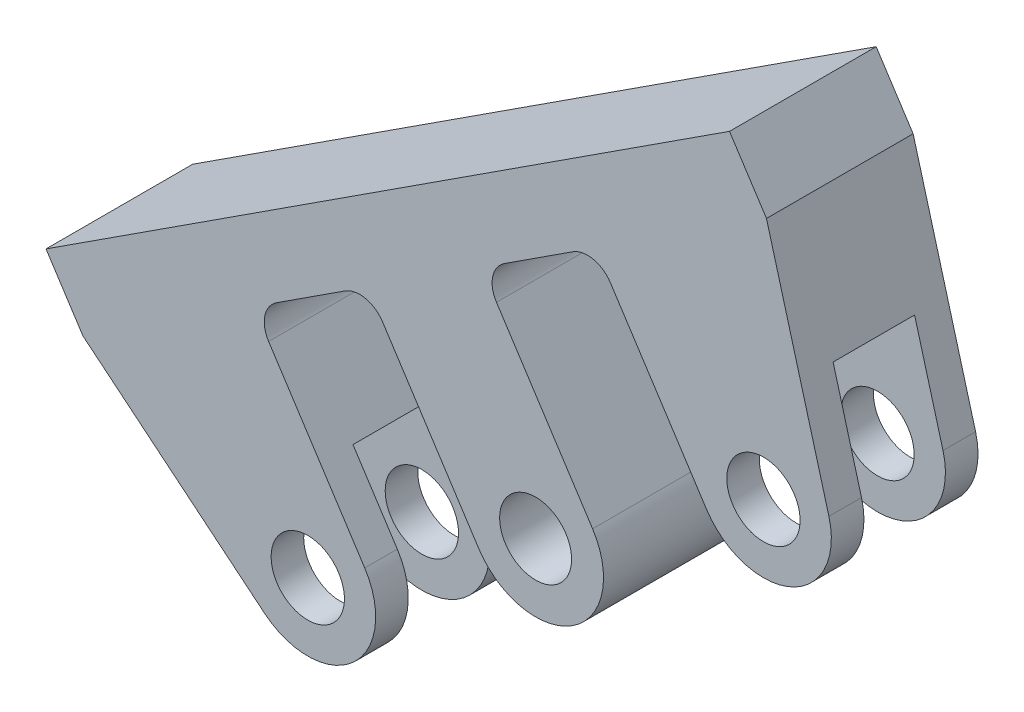
from build123d import *

# Parameters (mm, degrees)
SKETCH1_R               = 3.175
SKETCH1_R_2             = 3.1115
BOSS_EXTRUDE1_DEPTH     = 50.8
CUT_EXTRUDE1_DEPTH      = 3.81
CUT_EXTRUDE6_DEPTH      = 94.132822302
CUT_EXTRUDE7_DEPTH      = 81.280992342
CUT_EXTRUDE7_DEPTH_BACK = 81.280992342
SKETCH8_W               = 18.542
SKETCH8_H               = 31.75
SKETCH9_R               = 3.429
SKETCH9_R_2             = 3.3655
CUT_EXTRUDE8_DEPTH      = 77.458810064
FILLET1_R               = 2.54


with BuildPart() as part:
    # Sketch1 → Boss-Extrude1 (new body)
    with BuildSketch(Plane.XY):
        Polygon((-3.17337999, 28.220199493), (-67.093802786, -13.260151874), (-49.810323049, -39.893661373), (14.110099747, 1.586689995), align=None)
        Circle(SKETCH1_R, mode=Mode.SUBTRACT)
        with Locations((-42.613615197, -27.653567579)):
            Circle(SKETCH1_R, mode=Mode.SUBTRACT)
        with Locations((-21.306807599, -13.826783789)):
            Circle(SKETCH1_R_2, mode=Mode.SUBTRACT)
    extrude(amount=-BOSS_EXTRUDE1_DEPTH)

    # Sketch2 → Cut-Extrude1 (cut, symmetric)
    with BuildSketch(Plane.XY.offset(-25.4)):
        Polygon((-36.108246535, -14.348133404), (-57.415054133, -28.174917194), (-49.810323049, -39.893661373), (-39.15691925, -32.980269478), (-28.503515451, -26.066877584), align=None)
        Polygon((-14.801438936, -0.521349615), (6.505368663, 13.305434174), (14.110099747, 1.586689995), (3.456695947, -5.3267019), (-7.196707852, -12.240093794), align=None)
    extrude(amount=CUT_EXTRUDE1_DEPTH, both=True, mode=Mode.SUBTRACT)

    # Sketch7 → Cut-Extrude6 (cut, through all)
    with BuildSketch(Plane.XY):
        with BuildLine():
            Line((-47.65700114, -8.216765932), (-37.286913298, -24.196871631))
            ThreePointArc((-37.286913298, -24.196871631), (-36.524811659, -25.851077227), (-36.263615197, -27.653567579))
            ThreePointArc((-36.263615197, -27.653567579), (-37.033627746, -30.684448646), (-39.156919149, -32.980269413))
            Line((-39.156919149, -32.980269413), (-17.850111759, -19.153485759))
            ThreePointArc((-17.850111759, -19.153485759), (-22.629101551, -20.037583955), (-26.633509498, -17.283479737))
            Line((-26.633509498, -17.283479737), (-37.00359734, -1.303374038))
            Line((-37.00359734, -1.303374038), (-47.65700114, -8.216765932))
        make_face()
        with BuildLine():
            ThreePointArc((-14.956807599, -13.826783789), (-15.726820207, -16.857664966), (-17.850111759, -19.153485759))
            Line((-17.850111759, -19.153485759), (3.456695863, -5.326701954))
            ThreePointArc((3.456695863, -5.326701954), (-1.322293939, -6.210800169), (-5.3267019, -3.456695947))
            Line((-5.3267019, -3.456695947), (-15.696789742, 12.523409752))
            Line((-15.696789742, 12.523409752), (-26.350193541, 5.610017857))
            Line((-26.350193541, 5.610017857), (-15.980105699, -10.370087842))
            ThreePointArc((-15.980105699, -10.370087842), (-15.21800406, -12.024293437), (-14.956807599, -13.826783789))
        make_face()
        with BuildLine():
            ThreePointArc((6.35, 0), (5.579987398, -3.030881165), (3.456695863, -5.326701954))
            Line((3.456695863, -5.326701954), (14.110099747, 1.586689995))
            Line((14.110099747, 1.586689995), (0.283315957, 22.893497594))
            Line((0.283315957, 22.893497594), (6.122209073, 1.685543256))
            ThreePointArc((6.122209073, 1.685543256), (6.292794594, 0.850432945), (6.35, 0))
        make_face()
        with BuildLine():
            ThreePointArc((-39.156919149, -32.980269413), (-42.970845505, -33.993511309), (-46.646808241, -32.558244313))
            Line((-46.646808241, -32.558244313), (-63.637106839, -18.586853774))
            Line((-63.637106839, -18.586853774), (-49.810323049, -39.893661373))
            Line((-49.810323049, -39.893661373), (-39.156919149, -32.980269413))
        make_face()
    extrude(amount=-CUT_EXTRUDE6_DEPTH, mode=Mode.SUBTRACT)

    # Sketch8 → Cut-Extrude7 (cut, two sides: drawn at the far end of the back side and taken through both)
    with BuildSketch(Plane(origin=(-21.306807599, -13.826783789, 0), x_dir=(0, 0, -1), z_dir=(0.838850692859666, 0.5443615665059929, 0)).offset(-CUT_EXTRUDE7_DEPTH_BACK)):
        with Locations((9.271, 9.525)):
            Rectangle(SKETCH8_W, SKETCH8_H)
        with Locations((41.529, 9.525)):
            Rectangle(SKETCH8_W, SKETCH8_H)
    extrude(amount=CUT_EXTRUDE7_DEPTH + CUT_EXTRUDE7_DEPTH_BACK, mode=Mode.SUBTRACT)

    # Sketch9 → Cut-Extrude8 (cut, through all)
    with BuildSketch(Plane(origin=(0, 0, -32.258), x_dir=(-1, 0, 0), z_dir=(0, 0, -1))):
        Circle(SKETCH9_R)
        with Locations((21.306807599, -13.826783789)):
            Circle(SKETCH9_R_2)
        with Locations((42.613615197, -27.653567579)):
            Circle(SKETCH9_R)
    extrude(amount=-CUT_EXTRUDE8_DEPTH, mode=Mode.SUBTRACT)

    # Fillet1
    fillet1_edges = [part.edges().sort_by_distance(p)[0] for p in [
        (-15.696789742, 12.523409752, -25.4),
        (-26.350193541, 5.610017857, -25.4),
        (-37.00359734, -1.303374038, -25.4),
        (-47.65700114, -8.216765932, -25.4),
    ]]
    fillet(fillet1_edges, radius=FILLET1_R)


solid = part.part
